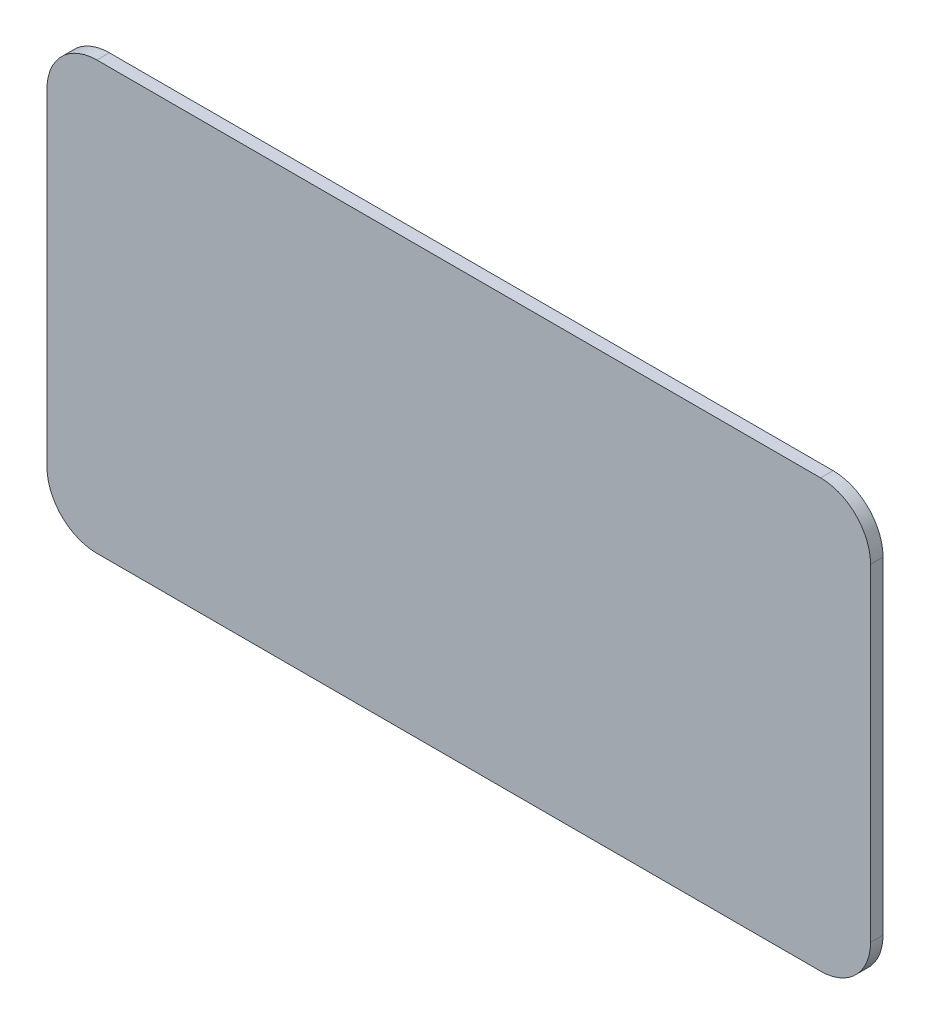
from build123d import *

# Parameters (mm, degrees)
SKETCH1_W           = 419.1
SKETCH1_H           = 217.424
BOSS_EXTRUDE1_DEPTH = 6.35
FILLET1_R           = 25.4
FILLET2_R           = 25.4
FILLET3_R           = 25.4
FILLET4_R           = 25.4


with BuildPart() as part:
    # Sketch1 → Boss-Extrude1 (new body)
    with BuildSketch(Plane.XY):
        with Locations((209.55, -108.712)):
            Rectangle(SKETCH1_W, SKETCH1_H)
    extrude(amount=BOSS_EXTRUDE1_DEPTH)

    # Fillet1
    fillet1_edges = [part.edges().sort_by_distance(p)[0] for p in [
        (419.1, 0, 3.175),
    ]]
    fillet(fillet1_edges, radius=FILLET1_R)

    # Fillet2
    fillet2_edges = [part.edges().sort_by_distance(p)[0] for p in [
        (0, 0, 3.175),
    ]]
    fillet(fillet2_edges, radius=FILLET2_R)

    # Fillet3
    fillet3_edges = [part.edges().sort_by_distance(p)[0] for p in [
        (0, -217.424, 3.175),
    ]]
    fillet(fillet3_edges, radius=FILLET3_R)

    # Fillet4
    fillet4_edges = [part.edges().sort_by_distance(p)[0] for p in [
        (419.1, -217.424, 3.175),
    ]]
    fillet(fillet4_edges, radius=FILLET4_R)


solid = part.part
